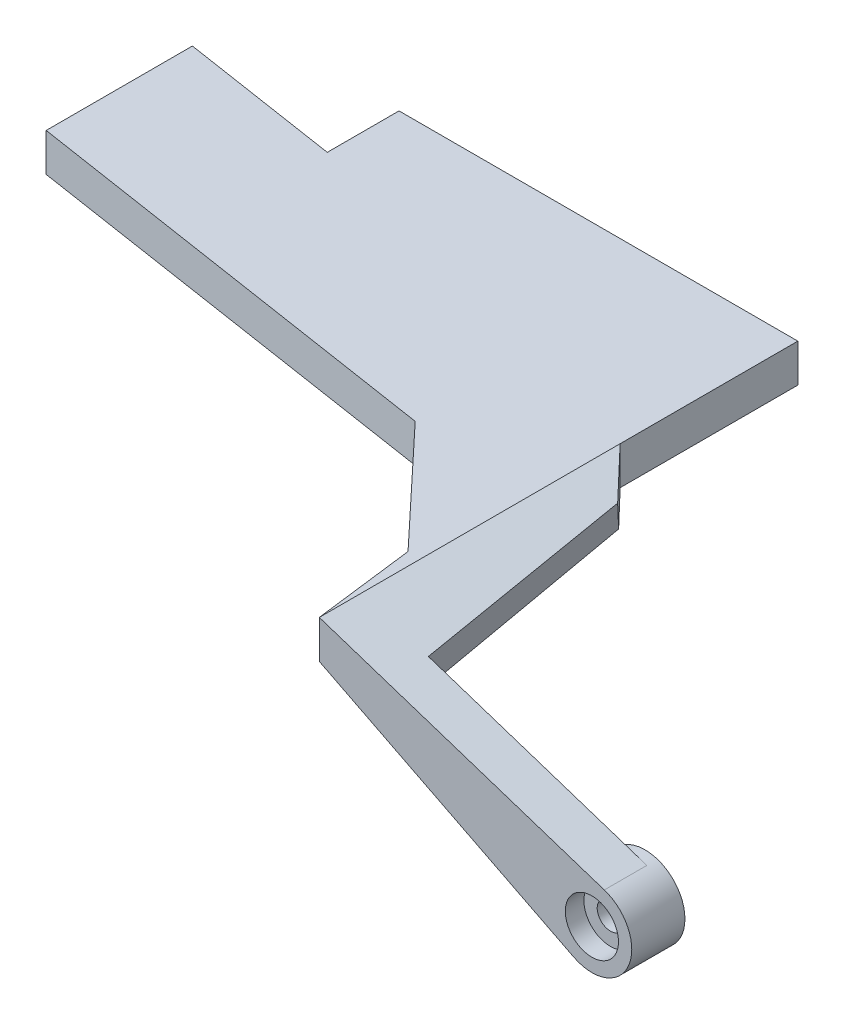
from build123d import *
from build123d.topology import SkipClean

# Parameters (mm, degrees)
CROQUIS1_R                  = 6
CROQUIS1_R_2                = 5
SALIENTE_EXTRUIR1_DEPTH     = 10
SALIENTE_EXTRUIR2_START     = -7
CROQUIS2_R                  = 5
CROQUIS2_R_2                = 2.5
SALIENTE_EXTRUIR2_DEPTH     = 7
CORTAR_EXTRUIR2_START       = -3.5
CROQUIS3_R                  = 5
CORTAR_EXTRUIR2_DEPTH       = 3.5
CROQUIS4_R                  = 6
CORTAR_EXTRUIR3_DEPTH       = 0.8
SALIENTE_EXTRUIR3_START     = -10
CROQUIS5_R                  = 7.5
CROQUIS5_R_2                = 5
SALIENTE_EXTRUIR3_DEPTH     = 10
SALIENTE_EXTRUIR4_START     = -8
SALIENTE_EXTRUIR4_DEPTH     = 8
CROQUIS7_W                  = 75
CROQUIS7_H                  = 7.168726593
SALIENTE_EXTRUIR5_DEPTH     = 90
SALIENTE_EXTRUIR6_DEPTH     = 7.168727
SALIENTE_EXTRUIR9_DEPTH     = 41
SALIENTE_EXTRUIR10_DEPTH    = 49
CORTAR_EXTRUIR4_START       = -41
CORTAR_EXTRUIR4_DEPTH       = 41
CORTAR_EXTRUIR5_DEPTH       = 143.675260973
CORTAR_EXTRUIR7_DEPTH       = 145.942427149
CORTAR_EXTRUIR8_DEPTH       = 145.942427149
CORTAR_EXTRUIR9_DEPTH       = 144.33727388
CROQUIS17_W                 = 30
CROQUIS17_H                 = 20.5
SALIENTE_EXTRUIR12_DEPTH    = 7.168727
CORTAR_EXTRUIR10_DEPTH      = 170.800324178
SALIENTE_EXTRUIR13_DEPTH    = 7.168723
SALIENTE_EXTRUIR14_DEPTH    = 7.168723
CORTAR_EXTRUIR12_DEPTH      = 171.613176039
CORTAR_EXTRUIR12_DEPTH_BACK = 171.613176039
SALIENTE_EXTRUIR15_DEPTH    = 7.168727
SALIENTE_EXTRUIR16_DEPTH    = 7.168727
SALIENTE_EXTRUIR17_DEPTH    = 2.399783
CORTAR_EXTRUIR13_DEPTH      = 165.428416042
CORTAR_EXTRUIR14_DEPTH      = 165.428416042
CORTAR_EXTRUIR15_DEPTH      = 150.41186397
CORTAR_EXTRUIR16_DEPTH      = 159.45665044


with BuildPart() as part:
    # Croquis1 → Saliente-Extruir1 (new body)
    with BuildSketch(Plane.XY):
        with Locations((10, 0)):
            Circle(CROQUIS1_R)
        with Locations((10, 0)):
            Circle(CROQUIS1_R_2, mode=Mode.SUBTRACT)
    extrude(amount=SALIENTE_EXTRUIR1_DEPTH)

    # Croquis2 → Saliente-Extruir2 (add)
    with BuildSketch(Plane.XY.offset(10).offset(SALIENTE_EXTRUIR2_START)):
        with Locations((10, 0)):
            Circle(CROQUIS2_R)
        with Locations((10, 0)):
            Circle(CROQUIS2_R_2, mode=Mode.SUBTRACT)
    extrude(amount=SALIENTE_EXTRUIR2_DEPTH)

    # Croquis3 → Cortar-Extruir2 (cut)
    with BuildSketch(Plane.XY.offset(10).offset(CORTAR_EXTRUIR2_START)):
        with Locations((10, 0)):
            Circle(CROQUIS3_R)
    extrude(amount=CORTAR_EXTRUIR2_DEPTH, mode=Mode.SUBTRACT)

    # Croquis4 → Cortar-Extruir3 (cut)
    with BuildSketch(Plane(origin=(0, 0, 0), x_dir=(-1, 0, 0), z_dir=(0, 0, -1))):
        with Locations((-10, 0)):
            Circle(CROQUIS4_R)
    extrude(amount=-CORTAR_EXTRUIR3_DEPTH, mode=Mode.SUBTRACT)

    # Croquis5 → Saliente-Extruir3 (add)
    with BuildSketch(Plane.XY.offset(10).offset(SALIENTE_EXTRUIR3_START)):
        with Locations((10, 0)):
            Circle(CROQUIS5_R)
        with Locations((10, 0)):
            Circle(CROQUIS5_R_2, mode=Mode.SUBTRACT)
    extrude(amount=SALIENTE_EXTRUIR3_DEPTH)

    # Croquis6 → Saliente-Extruir4 (add)
    with BuildSketch(Plane.XY.offset(10).offset(SALIENTE_EXTRUIR4_START)):
        with BuildLine():
            Line((-41.267602672, -17.548326339), (6.612435502, 6.691368079))
            ThreePointArc((6.612435502, 6.691368079), (3.071368624, -2.871248378), (12.338451231, -7.126124181))
            Line((12.338451231, -7.126124181), (-41.267602672, -24.717052932))
            Line((-41.267602672, -24.717052932), (-41.267602672, -17.548326339))
        make_face()
    extrude(amount=SALIENTE_EXTRUIR4_DEPTH)

    # Croquis7 → Saliente-Extruir5 (add)
    with BuildSketch(Plane.XY.offset(10)):
        with Locations((-78.767602672, -21.132689636)):
            Rectangle(CROQUIS7_W, CROQUIS7_H)
    extrude(amount=-SALIENTE_EXTRUIR5_DEPTH)

    # Croquis8 → Saliente-Extruir6 (add)
    with SkipClean():  # the faces are left unmerged after this step: merging them gives an invalid solid
        with BuildSketch(Plane.XZ.offset(24.717052932)):
            Polygon((-27.979148649, 2), (-41.267602672, -39), (-41.267602672, 2), align=None)
        extrude(amount=-SALIENTE_EXTRUIR6_DEPTH)

    # Croquis10 → Saliente-Extruir9 (add)
    with BuildSketch(Plane(origin=(0, 0, 2), x_dir=(-1, 0, 0), z_dir=(0, 0, -1))):
        Polygon((41.267602672, -17.548326339), (27.979148649, -17.548326339), (27.979148649, -10.820928511), align=None)
    extrude(amount=SALIENTE_EXTRUIR9_DEPTH)

    # Croquis11 → Saliente-Extruir10 (add)
    with BuildSketch(Plane(origin=(0, 0, -39), x_dir=(-1, 0, 0), z_dir=(0, 0, -1))):
        Polygon((41.267602672, -17.548326339), (41.267602672, -24.717052932), (27.979148649, -20.356421419), (27.979148649, -17.548326339), align=None)
    extrude(amount=-SALIENTE_EXTRUIR10_DEPTH)

    # Croquis12 → Cortar-Extruir4 (cut)
    with BuildSketch(Plane.XY.offset(2).offset(CORTAR_EXTRUIR4_START)):
        Polygon((-41.267602672, -24.717052932), (-27.979148649, -20.356421419), (-27.979148649, -24.717052932), align=None)
    extrude(amount=CORTAR_EXTRUIR4_DEPTH, mode=Mode.SUBTRACT)

    # Croquis13 → Cortar-Extruir5 (cut, through all)
    with BuildSketch(Plane(origin=(-1.347459035, 2.6616008, 0), x_dir=(0.89218241056854, 0.45167526639402034, 0), z_dir=(-0.45167526639402034, 0.89218241056854, 0))):
        Polygon((-29.850050056, -2), (-37.29721213, 39), (-29.850050056, 39), align=None)
    extrude(amount=-CORTAR_EXTRUIR5_DEPTH, mode=Mode.SUBTRACT)

    # Croquis14 → Cortar-Extruir7 (cut, through all)
    with BuildSketch(Plane(origin=(3.310603082, -10.088629756, 0), x_dir=(0.9501498907741007, 0.31179349746581414, 0), z_dir=(0.3117934974658141, -0.9501498907741006, 0))):
        Polygon((-29.95828018, 2), (-32.931384863, 2), (-36.10801617, -39), align=None)
    extrude(amount=-CORTAR_EXTRUIR7_DEPTH, mode=Mode.SUBTRACT)


with BuildPart() as cortar_extruir7_piece_1:
    # of the separate pieces the step leaves, piece 1, a body of its own (cortar_extruir7_pieces)
    add(part.part.solids().sort_by_distance((12.338451231, -7.126124181, 10))[0])


with BuildPart() as cortar_extruir7_piece_2:
    # of the separate pieces the step leaves, piece 2, a body of its own (cortar_extruir7_pieces)
    add(part.part.solids().sort_by_distance((-27.979148649, -20.356421419, -21.711689973))[0])


with BuildPart() as cortar_extruir8_tool:
    # Croquis15 → Cortar-Extruir8 (new, through all)
    with BuildSketch(Plane(origin=(3.310603082, -10.088629756, 0), x_dir=(0.9501498907741007, 0.31179349746581414, 0), z_dir=(0.3117934974658141, -0.9501498907741006, 0))):
        Polygon((-26.166370626, 2), (-33.745414131, 2), (-39.42969676, -39), (-33.745414131, -39), align=None)
    extrude(amount=-CORTAR_EXTRUIR8_DEPTH)


with BuildPart() as cortar_extruir7_piece_1_1:
    add(cortar_extruir7_piece_1.part)

    # Cortar-Extruir8: cut by cortar_extruir8_tool
    add(cortar_extruir8_tool.part, mode=Mode.SUBTRACT)

    # Croquis16 → Cortar-Extruir9 (cut, through all)
    with BuildSketch(Plane(origin=(0, -17.548326339, 0), x_dir=(1, 0, 0), z_dir=(0, 1, 0))):
        Polygon((-41.267602672, -10), (-46.041400107, 28.151463514), (-116.267602672, 39), (-116.267602672, -10), align=None)
    extrude(amount=-CORTAR_EXTRUIR9_DEPTH, mode=Mode.SUBTRACT)

    # Croquis17 → Saliente-Extruir12 (add)
    with SkipClean():  # the faces are left unmerged after this step: merging them gives an invalid solid
        with BuildSketch(Plane.XZ.offset(24.717052932)):
            with Locations((-131.267602672, -49.25)):
                Rectangle(CROQUIS17_W, CROQUIS17_H)
        extrude(amount=-SALIENTE_EXTRUIR12_DEPTH)

    # Croquis18 → Cortar-Extruir10 (cut, through all)
    with SkipClean():  # the faces are left unmerged after this step: merging them gives an invalid solid
        with BuildSketch(Plane.XZ.offset(24.717052932)):
            Polygon((-146.267602672, -59.5), (-116.267602672, -59.5), (-146.267602672, -64.144245374), align=None)
            Polygon((-116.267602672, -39), (-146.267602672, -43.634396888), (-146.267602672, -39), align=None)
        extrude(amount=-CORTAR_EXTRUIR10_DEPTH, mode=Mode.SUBTRACT)

    # Croquis19 → Saliente-Extruir13 (add)
    with SkipClean():  # the faces are left unmerged after this step: merging them gives an invalid solid
        with BuildSketch(Plane.XZ.offset(24.717052932)):
            Polygon((-146.267602672, -59.5), (-116.267602672, -59.5), (-146.267602672, -64.134396888), align=None)
        extrude(amount=-SALIENTE_EXTRUIR13_DEPTH)

    # Croquis20 → Saliente-Extruir14 (add)
    with SkipClean():  # the faces are left unmerged after this step: merging them gives an invalid solid
        with BuildSketch(Plane.XZ.offset(24.717052932)):
            Polygon((-146.267602672, -64.134396888), (-116.267602672, -59.5), (-116.267602672, -66.5), (-146.267602672, -71.134396888), align=None)
        extrude(amount=-SALIENTE_EXTRUIR14_DEPTH)

    # Simetría5: Cortar-Extruir7 piece 1 across plane


with BuildPart() as cortar_extruir7_piece_2_1:
    add(cortar_extruir7_piece_2.part)

    # Cortar-Extruir8: cut by cortar_extruir8_tool
    add(cortar_extruir8_tool.part, mode=Mode.SUBTRACT)


with BuildPart() as cortar_extruir7_piece_1_2:
    with SkipClean():  # the faces are left unmerged after this step: merging them gives an invalid solid
        add(cortar_extruir7_piece_1_1.part)
        add(cortar_extruir7_piece_1_1.part.mirror(Plane(origin=(-41.267602672, -24.717052932, -80), x_dir=(0, 0, 1), z_dir=(0, 1, 0))))

    # Croquis22 → Cortar-Extruir12 (cut, two sides: drawn at the far end of the back side and taken through both)
    with SkipClean():  # the faces are left unmerged after this step: merging them gives an invalid solid
        with BuildSketch(Plane(origin=(3.174348647, 0, -20.548619752), x_dir=(0.988277380271317, 0, 0.15266898717179916), z_dir=(-0.15266898717179916, 0, 0.988277380271317)).offset(-CORTAR_EXTRUIR12_DEPTH_BACK)):
            Polygon((-151.214582366, -24.717052932), (-160.929410211, -24.717052932), (-160.929410211, 29.151790767), (25.906832494, 29.151790767), (25.906832494, -24.717052932), align=None)
        extrude(amount=CORTAR_EXTRUIR12_DEPTH + CORTAR_EXTRUIR12_DEPTH_BACK, mode=Mode.SUBTRACT)

    # Croquis25 → Saliente-Extruir15 (add)
    with SkipClean():  # the faces are left unmerged after this step: merging them gives an invalid solid
        with BuildSketch(Plane.XZ.offset(31.885779526)):
            Polygon((-43.654501389, -9.075731757), (-64.181393268, -30.953727775), (-46.041400107, -28.151463514), align=None)
        extrude(amount=-SALIENTE_EXTRUIR15_DEPTH)

    # Croquis26 → Saliente-Extruir16 (add)
    with SkipClean():  # the faces are left unmerged after this step: merging them gives an invalid solid
        with BuildSketch(Plane.XZ.offset(31.885779526)):
            Polygon((-34.153518988, -39), (-41.267602672, -46.58234103), (-41.267602672, -39), align=None)
        extrude(amount=-SALIENTE_EXTRUIR16_DEPTH)

    # Croquis27 → Saliente-Extruir17 (add)
    with SkipClean():  # the faces are left unmerged after this step: merging them gives an invalid solid
        with BuildSketch(Plane.XZ.offset(31.885779526)):
            Polygon((-41.267602672, -39), (-34.153518988, -39), (-41.267602672, -46.58234103), align=None)
        extrude(amount=SALIENTE_EXTRUIR17_DEPTH)

    # Croquis28 → Cortar-Extruir13 (cut, through all)
    with SkipClean():  # the faces are left unmerged after this step: merging them gives an invalid solid
        with BuildSketch(Plane.XY.offset(-39)):
            Polygon((-41.267602672, -31.885779526), (-41.267602672, -34.285562838), (-36.527373087, -34.285562838), align=None)
            Polygon((-41.267602672, -24.717052932), (-34.153518988, -24.717052932), (-34.153518988, -27.051553051), align=None)
        extrude(amount=-CORTAR_EXTRUIR13_DEPTH, mode=Mode.SUBTRACT)

    # Croquis29 → Cortar-Extruir14 (cut, through all)
    with SkipClean():  # the faces are left unmerged after this step: merging them gives an invalid solid
        with BuildSketch(Plane.XY.offset(-39)):
            Polygon((-34.153518988, -27.051553051), (-36.527373087, -34.285562838), (-34.153518988, -34.285562838), align=None)
        extrude(amount=-CORTAR_EXTRUIR14_DEPTH, mode=Mode.SUBTRACT)

    # Croquis30 → Cortar-Extruir15 (cut, through all)
    with SkipClean():  # the faces are left unmerged after this step: merging them gives an invalid solid
        with BuildSketch(Plane(origin=(-21.268253266, -42.010627722, 0), x_dir=(0.8921824105685466, -0.4516752663940073, 0), z_dir=(-0.4516752663940073, -0.8921824105685466, 0))):
            Polygon((-17.103139044, -39), (-17.103139044, -41.530103964), (-17.512588728, -41.919452496), align=None)
        extrude(amount=-CORTAR_EXTRUIR15_DEPTH, mode=Mode.SUBTRACT)

    # Croquis33 → Cortar-Extruir16 (cut, through all)
    with SkipClean():  # the faces are left unmerged after this step: merging them gives an invalid solid
        with BuildSketch(Plane(origin=(-11.334278343, -34.539730358, 0), x_dir=(0.9501498907741053, -0.31179349746580015, 0), z_dir=(0.31179349746580015, 0.9501498907741053, 0))):
            Polygon((-24.016463998, 39), (-24.421219928, 41.919452496), (-24.016463998, 40.933309055), align=None)
        extrude(amount=-CORTAR_EXTRUIR16_DEPTH, mode=Mode.SUBTRACT)


solid = cortar_extruir7_piece_1_2.part
